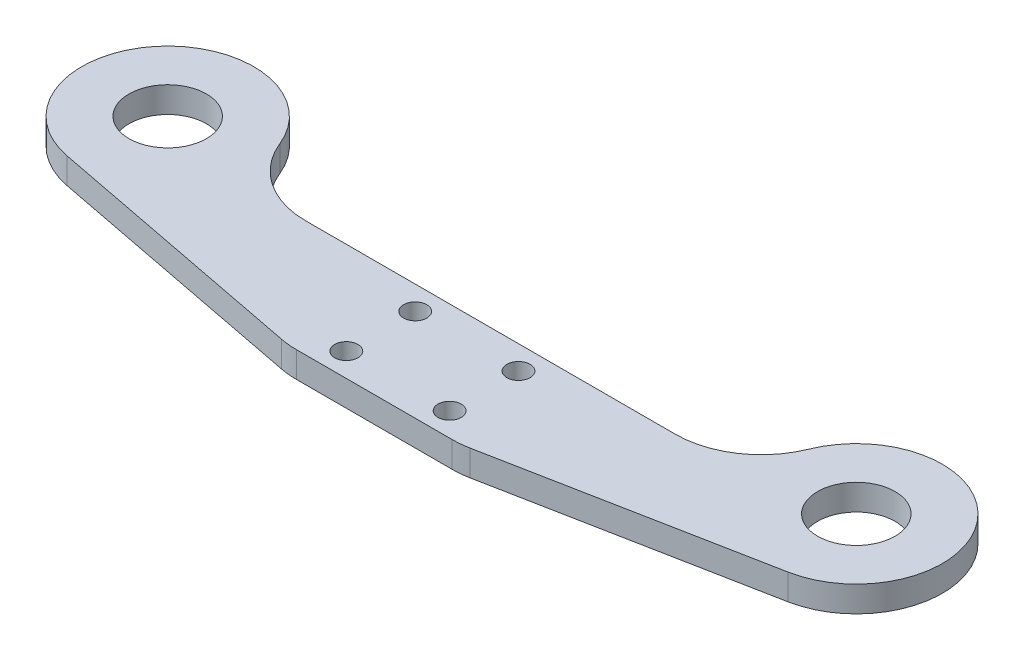
from build123d import *

# Parameters (mm, degrees)
SKETCH_1_R      = 4.5
SKETCH_1_R_2    = 1.35
EXTRUDE_1_DEPTH = 3
FILLET_1_R      = 10
FILLET_2_R      = 10


with BuildPart() as part:
    # 草图1 → 凸台-拉伸1 (new body)
    with BuildSketch(Plane(origin=(0, 0, 0), x_dir=(1, 0, 0), z_dir=(0, 1, 0))):
        with BuildLine():
            Line((-41.902581816, -0.567340904), (-10, -6.75))
            Line((-10, -6.75), (10, -6.75))
            Line((10, -6.75), (41.902581816, -0.567340904))
            ThreePointArc((41.902581816, -0.567340904), (45.340176894, 17.704733038), (30.317541634, 6.75))
            Line((30.317541634, 6.75), (-30.317541634, 6.75))
            ThreePointArc((-30.317541634, 6.75), (-45.340176894, 17.704733038), (-41.902581816, -0.567340904))
        make_face()
        with Locations(Location((-40, 9.25, 0), (0, 0, 270))):
            Circle(SKETCH_1_R, mode=Mode.SUBTRACT)
        with Locations(Location((-6, -4, 0), (0, 0, 270))):
            Circle(SKETCH_1_R_2, mode=Mode.SUBTRACT)
        with Locations(Location((-6, 4, 0), (0, 0, 270))):
            Circle(SKETCH_1_R_2, mode=Mode.SUBTRACT)
        with Locations(Location((6, -4, 0), (0, 0, 270))):
            Circle(SKETCH_1_R_2, mode=Mode.SUBTRACT)
        with Locations(Location((6, 4, 0), (0, 0, 270))):
            Circle(SKETCH_1_R_2, mode=Mode.SUBTRACT)
        with Locations(Location((40, 9.25, 0), (0, 0, 270))):
            Circle(SKETCH_1_R, mode=Mode.SUBTRACT)
    extrude(amount=EXTRUDE_1_DEPTH)

    # 圆角1
    fillet_1_edges = [part.edges().sort_by_distance(p)[0] for p in [
        (-30.317541634, 1.5, -6.75),
        (30.317541634, 1.5, -6.75),
    ]]
    fillet(fillet_1_edges, radius=FILLET_1_R)

    # 圆角2
    fillet_2_edges = [part.edges().sort_by_distance(p)[0] for p in [
        (10, 1.5, 6.75),
        (-10, 1.5, 6.75),
    ]]
    fillet(fillet_2_edges, radius=FILLET_2_R)


solid = part.part
